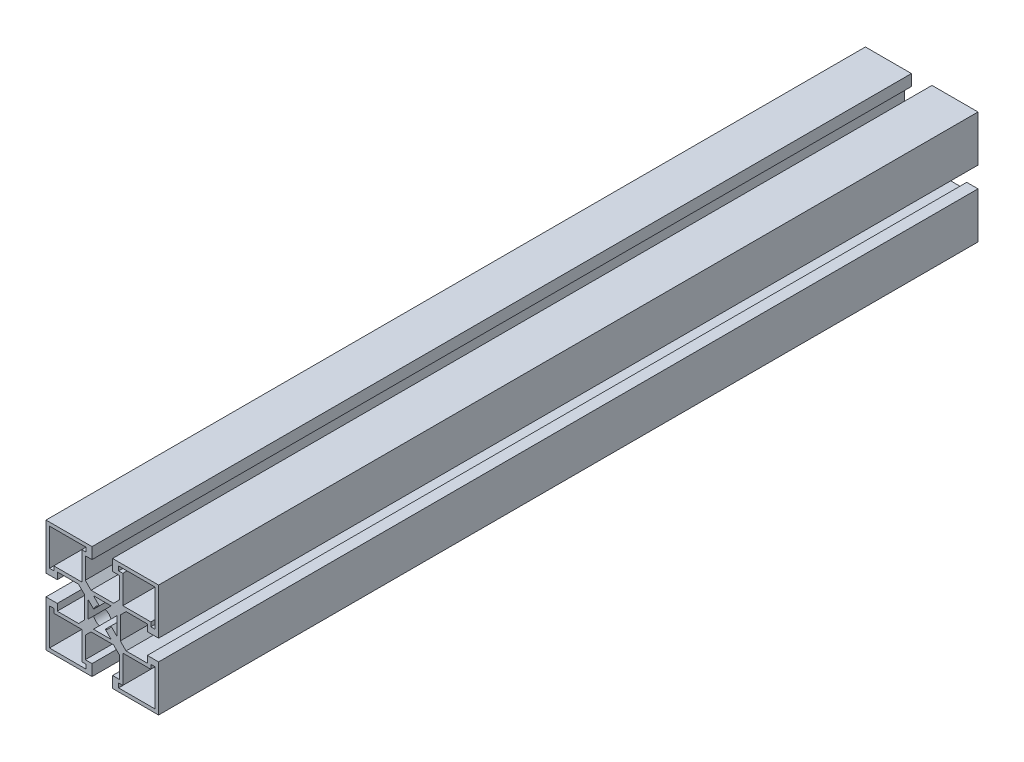
from build123d import *

# Parameters (mm, degrees)
BOSS_EXTRUDE1_DEPTH = 327.500000024


with BuildPart() as part:
    # Sketch1 → Boss-Extrude1 (new body)
    with BuildSketch(Plane.XY):
        Polygon((-22.499997904, -22.500007621), (-4.099997904, -22.500007621), (-4.099997904, -18.000007621), (-6.799997904, -18.000007621), (-6.799997904, -9.500007621), (-4.499997904, -7.200007621), (4.500002096, -7.200007621), (6.800002096, -9.500007621), (6.800002096, -18.000007621), (4.100002096, -18.000007621), (4.100002096, -22.500007621), (22.500002096, -22.500007621), (22.500002096, -4.100007621), (18.000002096, -4.100007621), (18.000002096, -6.800007621), (9.500002096, -6.800007621), (7.200002096, -4.500007621), (7.200002096, 4.499992379), (9.500002096, 6.799992379), (18.000002096, 6.799992379), (18.000002096, 4.099992379), (22.500002096, 4.099992379), (22.500002096, 22.499992379), (4.100002096, 22.499992379), (4.100002096, 17.999992379), (6.800002096, 17.999992379), (6.800002096, 9.499992379), (4.500002096, 7.199992379), (-4.499997904, 7.199992379), (-6.799997904, 9.499992379), (-6.799997904, 17.999992379), (-4.099997904, 17.999992379), (-4.099997904, 22.499992379), (-22.499997904, 22.499992379), (-22.499997904, 4.099992379), (-17.999997904, 4.099992379), (-17.999997904, 6.799992379), (-9.499997904, 6.799992379), (-7.199997904, 4.499992379), (-7.199997904, -4.500007621), (-9.499997904, -6.800007621), (-17.999997904, -6.800007621), (-17.999997904, -4.100007621), (-22.499997904, -4.100007621), align=None)
        Polygon((8.200003223, 8.199980186), (8.199989777, 19.399992368), (6.500002085, 19.399992368), (6.500002085, 21.099984758), (21.100004192, 21.099984758), (21.100004192, 6.499980188), (19.400009891, 6.499980188), (19.400009891, 8.199980186), align=None, mode=Mode.SUBTRACT)
        Polygon((-19.399997893, 6.499992368), (-21.099990283, 6.499992368), (-21.099990283, 21.099994475), (-6.499974376, 21.099994475), (-6.49997587, 19.399985233), (-8.199975868, 19.399986727), (-8.199985712, 8.19998006), (-19.399997893, 8.19998006), align=None, mode=Mode.SUBTRACT)
        Polygon((-6.499997893, -21.1), (-21.1, -21.1), (-21.1, -6.499995431), (-19.400002096, -6.499995431), (-19.400002096, -8.199995429), (-8.199995429, -8.199995429), (-8.199995429, -19.40000761), (-6.499997893, -19.400009104), align=None, mode=Mode.SUBTRACT)
        Polygon((6.499989905, -19.400011813), (8.199989903, -19.400011813), (8.199989903, -8.200005146), (19.400002085, -8.200005146), (19.400003579, -6.500017454), (21.099994475, -6.500018948), (21.099994475, -21.100009717), (6.499989905, -21.100009717), align=None, mode=Mode.SUBTRACT)
        with BuildLine():
            Line((-5.799999723, 3.537265469), (-3.451121085, 1.18838683))
            ThreePointArc((-3.451121085, 1.18838683), (-2.580942431, 2.580937072), (-1.188393996, 3.451118617))
            Line((-1.188393996, 3.451118617), (-3.537277512, 5.799992379))
            Line((-3.537277512, 5.799992379), (3.537277512, 5.799992379))
            Line((3.537277512, 5.799992379), (1.188393996, 3.451118617))
            ThreePointArc((1.188393996, 3.451118617), (2.580942431, 2.580937072), (3.451121085, 1.18838683))
            Line((3.451121085, 1.18838683), (5.799999723, 3.537265469))
            Line((5.799999723, 3.537265469), (5.799985034, -3.537266022))
            Line((5.799985034, -3.537266022), (3.451117181, -1.188398168))
            ThreePointArc((3.451117181, -1.188398168), (2.580938191, -2.580941312), (1.188393996, -3.451118617))
            Line((1.188393996, -3.451118617), (3.537277512, -5.799992379))
            Line((3.537277512, -5.799992379), (-3.537277512, -5.799992379))
            Line((-3.537277512, -5.799992379), (-1.188393996, -3.451118617))
            ThreePointArc((-1.188393996, -3.451118617), (-2.580938191, -2.580941311), (-3.451117181, -1.188398168))
            Line((-3.451117181, -1.188398168), (-5.799985034, -3.537266022))
            Line((-5.799985034, -3.537266022), (-5.799999723, 3.537265469))
        make_face(mode=Mode.SUBTRACT)
    extrude(amount=BOSS_EXTRUDE1_DEPTH)


solid = part.part
